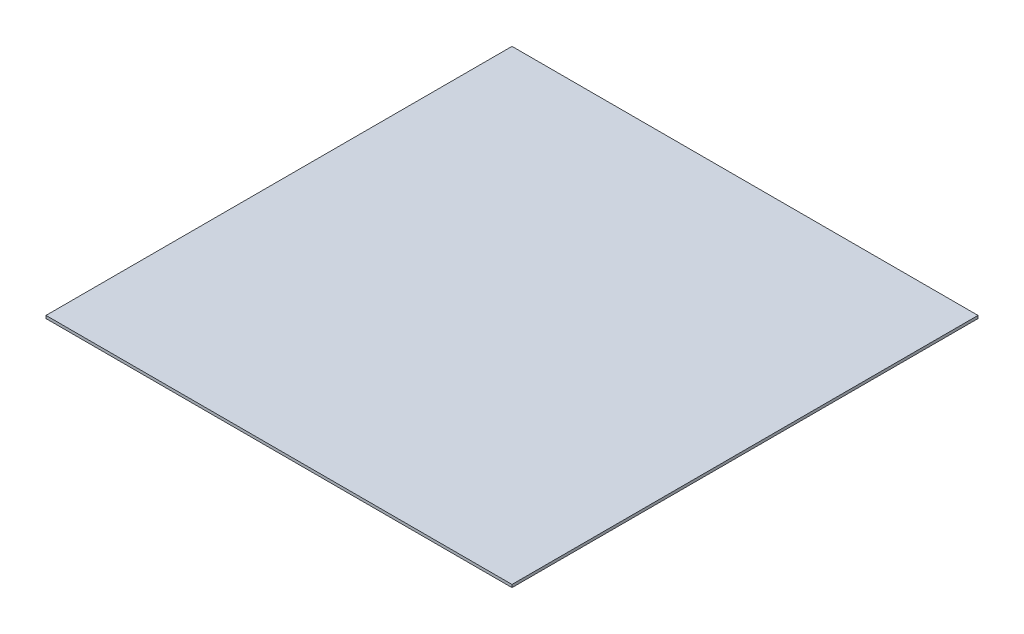
from build123d import *

# Parameters (mm, degrees)
SKETCH_1_W      = 500
SKETCH_1_H      = 500
EXTRUDE_1_DEPTH = 1.5


with BuildPart() as part:
    # Эскиз1 → Бобышка-Вытянуть1 (new, symmetric)
    with BuildSketch(Plane(origin=(0, 0, 0), x_dir=(1, 0, 0), z_dir=(0, 1, 0))):
        Rectangle(SKETCH_1_W, SKETCH_1_H)
    extrude(amount=EXTRUDE_1_DEPTH, both=True)


solid = part.part
